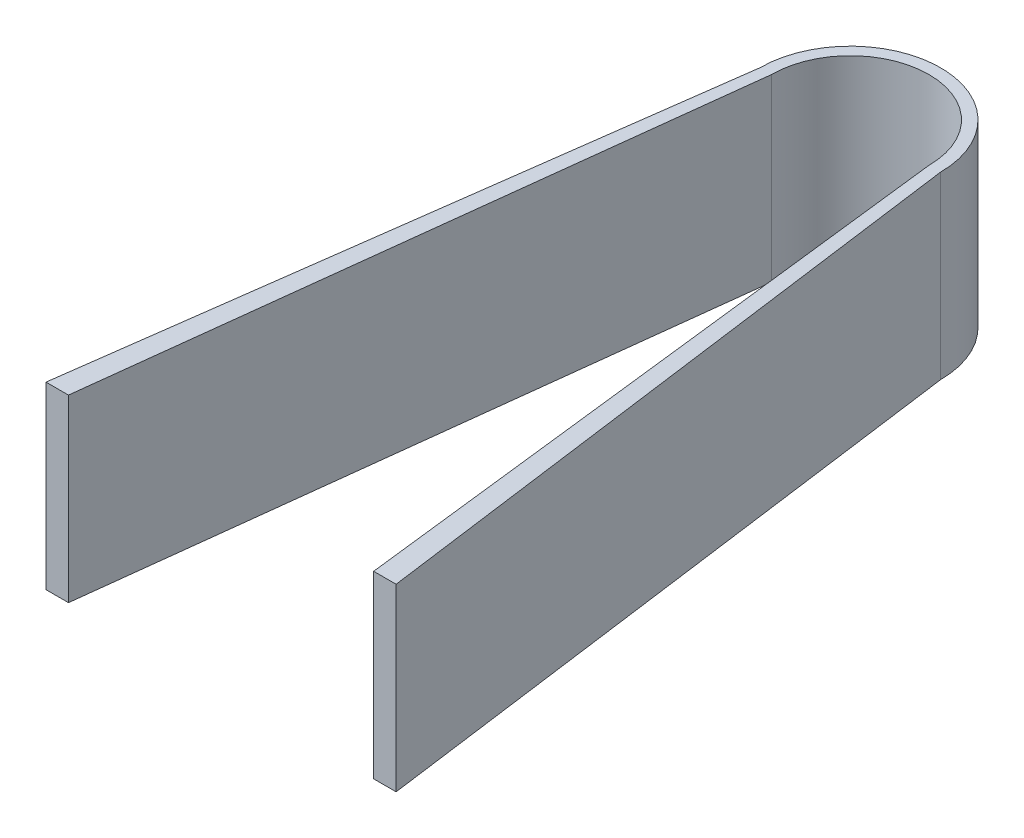
from build123d import *

# Parameters (mm, degrees)
BOSS_EXTRUDE1_DEPTH = 25.4


with BuildPart() as part:
    # Sketch1 → Boss-Extrude1 (new body)
    with BuildSketch(Plane(origin=(0, 0, 0), x_dir=(1, 0, 0), z_dir=(0, 1, 0))):
        with BuildLine():
            Line((-11.1125, 0), (-21.558031073, -88.898868747))
            Line((-21.558031073, -88.898868747), (-24.733031073, -88.898868747))
            Line((-24.733031073, -88.898868747), (-12.7635, 0))
            ThreePointArc((-12.7635, 0), (0, 12.7635), (12.7635, 0))
            Line((12.7635, 0), (24.733031073, -88.898868747))
            Line((24.733031073, -88.898868747), (21.558031073, -88.898868747))
            Line((21.558031073, -88.898868747), (11.1125, 0))
            ThreePointArc((11.1125, 0), (0, 11.1125), (-11.1125, 0))
        make_face()
    extrude(amount=BOSS_EXTRUDE1_DEPTH)


solid = part.part
